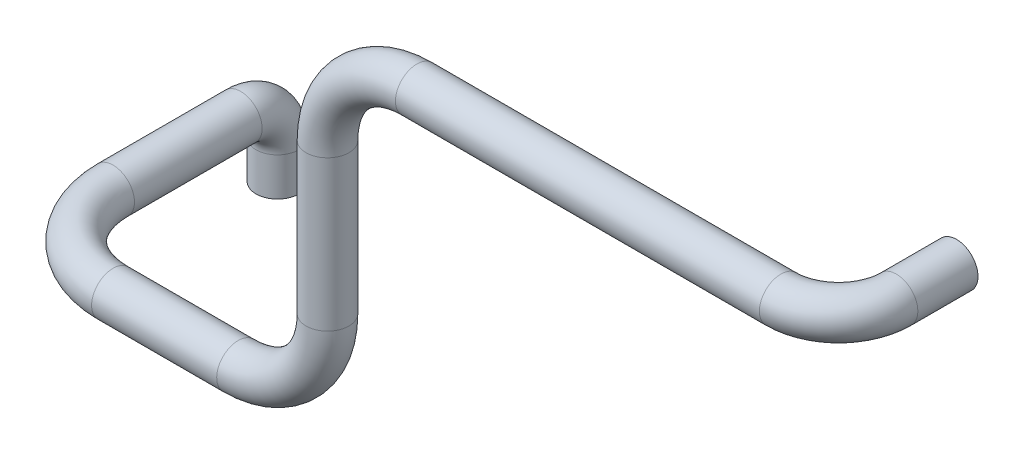
from build123d import *

# Parameters (mm, degrees)
SWEEP1_PROFILE_R                           = 6
HOLLOW_TUBE_OD_AND_WALL_PROVISIONAL_PROF_R = 5


with BuildPart() as part:
    # Sweep1: sweep along a curve in space
    with BuildLine() as sweep1_path:
        Line((0, 0, 0), (0, 0, 16.830001189))
        ThreePointArc((0, 0, 16.830001189), (-4.73608342, 0, 28.26391742), (-16.17, 0, 33))
        Line((-16.17, 0, 33), (-118.000001606, 0, 33))
        ThreePointArc((-118.000001606, 0, 33), (-135.677670568, -7.322330568, 33), (-143, -25, 33))
        Line((-143, -25, 33), (-143, -67.000001606, 33))
        ThreePointArc((-143, -67.000001606, 33), (-150.322330568, -84.677670568, 33), (-168, -92, 33))
        Line((-168, -92, 33), (-203.000001606, -92, 33))
        ThreePointArc((-203.000001606, -92, 33), (-220.677670568, -92, 25.677669432), (-228, -92, 8))
        Line((-228, -92, 8), (-228, -92, -27.710000757))
        ThreePointArc((-228, -92, -27.710000757), (-228, -95.013871267, -34.986129267), (-228, -102.29, -38))
        Line((-228, -102.29, -38), (-228, -113, -38))
    # Sweep1 profile (on start of the path) → Sweep1 (sweep)
    with BuildSketch(Plane.XY):
        Circle(SWEEP1_PROFILE_R)
    sweep(path=sweep1_path.line)

    # Hollow_tube_OD_and_wall_PROVISIONAL: sweep along a curve in space
    with BuildLine() as hollow_tube_od_and_wall_provisional_path:
        Line((0, 0, 0), (0, 0, 16.830001189))
        ThreePointArc((0, 0, 16.830001189), (-4.73608342, 0, 28.26391742), (-16.17, 0, 33))
        Line((-16.17, 0, 33), (-118.000001606, 0, 33))
        ThreePointArc((-118.000001606, 0, 33), (-135.677670568, -7.322330568, 33), (-143, -25, 33))
        Line((-143, -25, 33), (-143, -67.000001606, 33))
        ThreePointArc((-143, -67.000001606, 33), (-150.322330568, -84.677670568, 33), (-168, -92, 33))
        Line((-168, -92, 33), (-203.000001606, -92, 33))
        ThreePointArc((-203.000001606, -92, 33), (-220.677670568, -92, 25.677669432), (-228, -92, 8))
        Line((-228, -92, 8), (-228, -92, -27.710000757))
        ThreePointArc((-228, -92, -27.710000757), (-228, -95.013871267, -34.986129267), (-228, -102.29, -38))
        Line((-228, -102.29, -38), (-228, -113, -38))
    # Hollow_tube_OD_and_wall_PROVISIONAL prof (on start of the path) → Hollow_tube_OD_and_wall_PROVISIONAL (sweep, cut)
    with BuildSketch(Plane.XY):
        Circle(HOLLOW_TUBE_OD_AND_WALL_PROVISIONAL_PROF_R)
    sweep(path=hollow_tube_od_and_wall_provisional_path.line, mode=Mode.SUBTRACT)


solid = part.part
